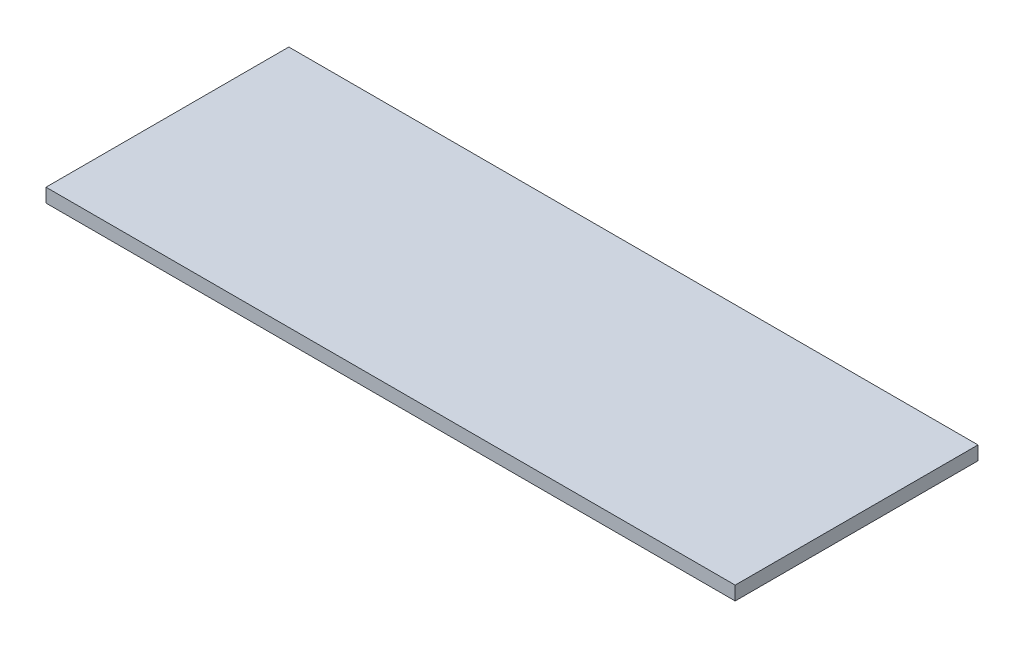
from build123d import *

# Parameters (mm, degrees)
SKETCH1_W           = 170
SKETCH1_H           = 140
BOSS_EXTRUDE1_DEPTH = 4
SKETCH2_W           = 200
SKETCH2_H           = 70.464044802
BOSS_EXTRUDE2_DEPTH = 4
SKETCH3_W           = 180
SKETCH3_H           = 170
CUT_EXTRUDE2_DEPTH  = 10
SKETCH4_W           = 208.329429668
SKETCH4_H           = 25.795902732
CUT_EXTRUDE3_DEPTH  = 10


with BuildPart() as part:
    # Sketch1 → Boss-Extrude1 (new body)
    with BuildSketch(Plane(origin=(0, 0, 0), x_dir=(1, 0, 0), z_dir=(0, 1, 0))):
        with Locations((85, 70)):
            Rectangle(SKETCH1_W, SKETCH1_H)
    extrude(amount=BOSS_EXTRUDE1_DEPTH)

    # Sketch2 → Boss-Extrude2 (add)
    with BuildSketch(Plane(origin=(0, 4, 0), x_dir=(1, 0, 0), z_dir=(0, 1, 0))):
        with Locations((0, 65.310473928)):
            Rectangle(SKETCH2_W, SKETCH2_H)
    extrude(amount=BOSS_EXTRUDE2_DEPTH)

    # Sketch3 → Cut-Extrude2 (cut)
    with BuildSketch(Plane(origin=(0, 4, 0), x_dir=(1, 0, 0), z_dir=(0, 1, 0))):
        with Locations((80.942291323, 86.090427605)):
            Rectangle(SKETCH3_W, SKETCH3_H)
    extrude(amount=-CUT_EXTRUDE2_DEPTH, mode=Mode.SUBTRACT)


with BuildPart() as cut_extrude2_piece_1:
    # of the separate pieces the step leaves, piece 1, a body of its own (cut_extrude2_pieces)
    add(part.part.solids().sort_by_distance((100, 4, -30.078451527))[0])


with BuildPart() as cut_extrude2_piece_2:
    # of the separate pieces the step leaves, piece 2, a body of its own (cut_extrude2_pieces)
    add(part.part.solids().sort_by_distance((0, 0, 0))[0])

    # Sketch4 → Cut-Extrude3 (cut)
    with BuildSketch(Plane(origin=(0, 4, 0), x_dir=(1, 0, 0), z_dir=(0, 1, 0))):
        with Locations((90.618611287, -0.959663867)):
            Rectangle(SKETCH4_W, SKETCH4_H)
    extrude(amount=-CUT_EXTRUDE3_DEPTH, mode=Mode.SUBTRACT)


solid = cut_extrude2_piece_1.part
